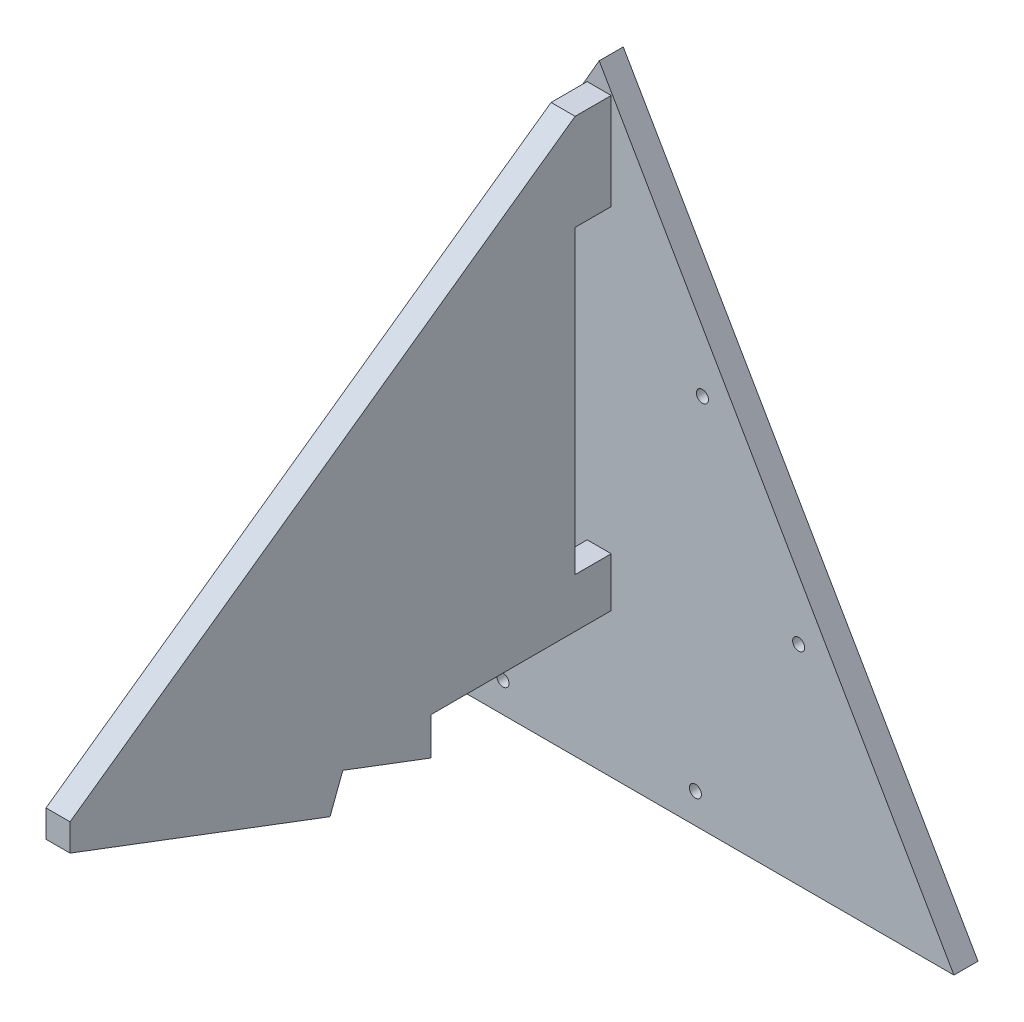
from build123d import *

# Parameters (mm, degrees)
BOSS_EXTRUDE1_DEPTH = 2
BOSS_EXTRUDE2_DEPTH = 1
SKETCH3_R           = 0.5
CUT_EXTRUDE1_DEPTH  = 64.683462008
CIRPATTERN1_COUNT   = 3


with BuildPart() as part:
    # Sketch1 → Boss-Extrude1 (new body)
    with BuildSketch(Plane.XY):
        Polygon((0, 34.063665882), (-29.5, -17.031832941), (29.5, -17.031832941), align=None)
    extrude(amount=BOSS_EXTRUDE1_DEPTH)

    # Sketch2 → Boss-Extrude2 (add, symmetric)
    with BuildSketch(Plane(origin=(0, 0, 0), x_dir=(0, 0, -1), z_dir=(1, 0, 0))):
        Polygon((-2, -0.936334118), (-2, -5.031832941), (-17, -5.031832941), (-17, -8.146867769), (-24.319391415, -5.376586618), (-25.381329824, -8.182346196), (-47, 0), (-47, 2.259927745), (-5, 32.063665882), (-2, 32.063665882), (-2, 24.063665882), (-5, 24.063665882), (-5, -0.936334118), align=None)
    extrude(amount=BOSS_EXTRUDE2_DEPTH, both=True)

    # Sketch3 → Cut-Extrude1 (cut, through all)
    with BuildSketch(Plane.XY.offset(2)):
        with Locations((-8, -14.531832941)):
            Circle(SKETCH3_R)
        with Locations((8, -14.531832941)):
            Circle(SKETCH3_R)
    cut_extrude1 = extrude(amount=-CUT_EXTRUDE1_DEPTH, mode=Mode.SUBTRACT)

    # CirPattern1: Cut-Extrude1 ×3 about axis
    cirpattern1_axis = Axis((0, 0, -2.35), (0, 0, 1))
    for i in range(1, CIRPATTERN1_COUNT):
        add(cut_extrude1.rotate(cirpattern1_axis, i * 360 / CIRPATTERN1_COUNT), mode=Mode.SUBTRACT)


solid = part.part
